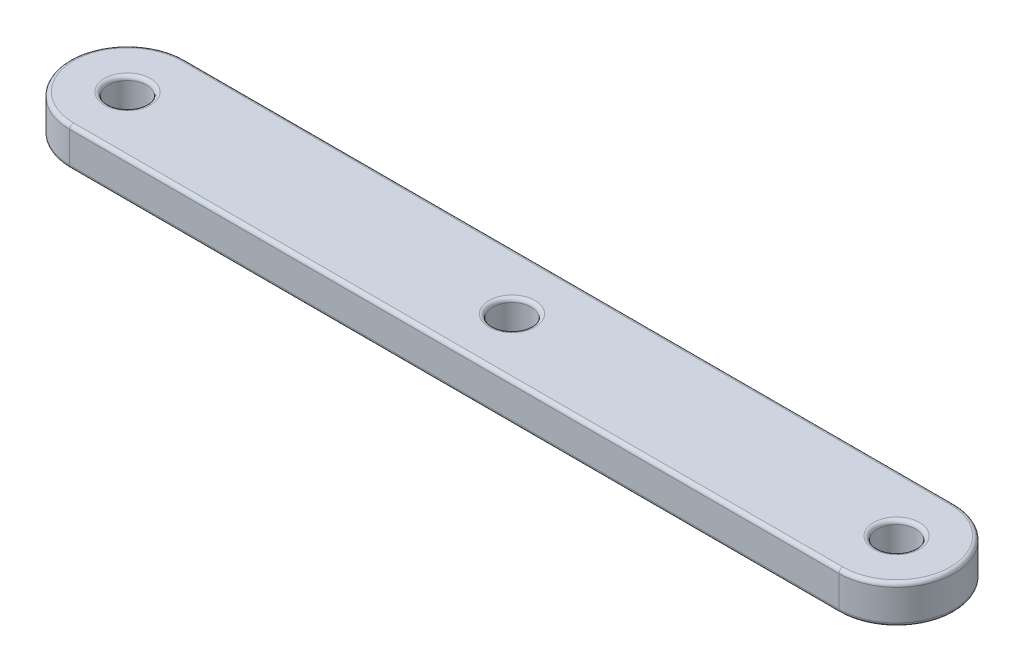
from build123d import *

# Parameters (mm, degrees)
SKETCH_1_R      = 5
EXTRUDE_1_DEPTH = 10
FILLET_1_R      = 1
FILLET_2_R      = 1


with BuildPart() as part:
    # 草图1 → 凸台-拉伸1 (new body)
    with BuildSketch(Plane(origin=(0, 0, 0), x_dir=(1, 0, 0), z_dir=(0, 1, 0))):
        with BuildLine():
            Line((0, 15), (200, 15))
            ThreePointArc((200, 15), (215, 0), (200, -15))
            Line((200, -15), (0, -15))
            ThreePointArc((0, -15), (-15, 0), (0, 15))
        make_face()
        with Locations(Location((200, 0, 0), (0, 0, 270))):
            Circle(SKETCH_1_R, mode=Mode.SUBTRACT)
        with Locations(Location((100, 0, 0), (0, 0, 270))):
            Circle(SKETCH_1_R, mode=Mode.SUBTRACT)
        with Locations(Location((0, 0, 0), (0, 0, 270))):
            Circle(SKETCH_1_R, mode=Mode.SUBTRACT)
    extrude(amount=EXTRUDE_1_DEPTH)

    # 圆角1
    fillet_1_edges = [part.edges().sort_by_distance(p)[0] for p in [
        (200, 0, -5),
        (215, 10, 0),
        (100, 0, -5),
        (100, 10, -15),
        (0, 0, -5),
        (-15, 10, 0),
        (100, 0, -15),
        (215, 0, 0),
        (100, 0, 15),
        (-15, 0, 0),
        (100, 10, 15),
    ]]
    fillet(fillet_1_edges, radius=FILLET_1_R)

    # 圆角2
    fillet_2_edges = [part.edges().sort_by_distance(p)[0] for p in [
        (200, 10, -5),
        (100, 10, -5),
        (0, 10, -5),
    ]]
    fillet(fillet_2_edges, radius=FILLET_2_R)


solid = part.part
